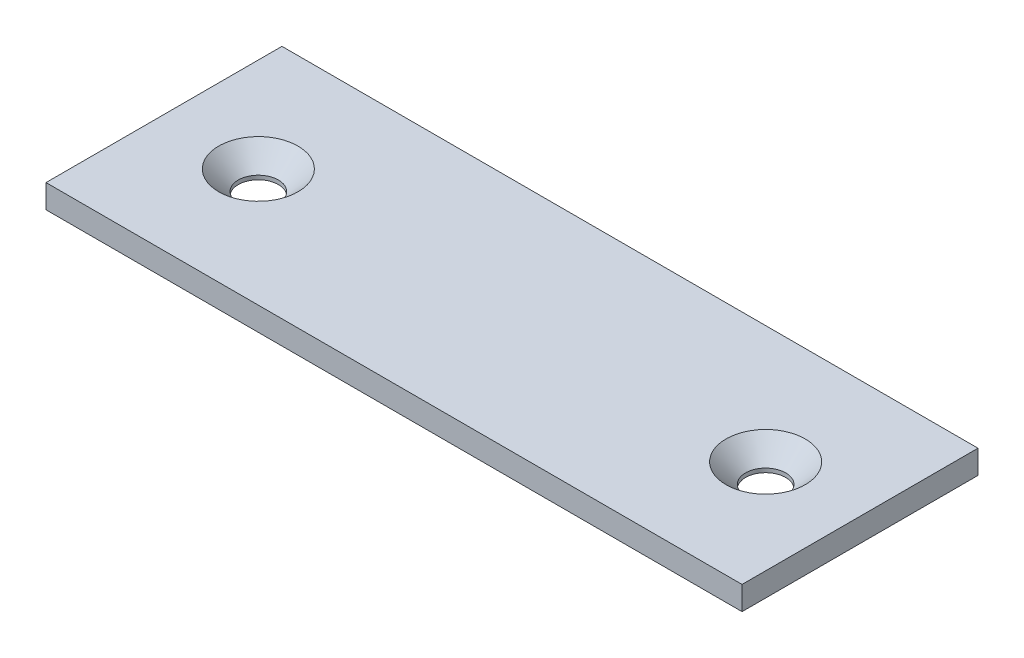
from build123d import *

# Parameters (mm, degrees)
EXTRUDE_765_DEPTH           = 10
EXTRUDE_765_DEPTH_BACK      = 10
HOLE_WIZARD_M3_2_AT_2_COUNT = 2
HOLE_WIZARD_M3_2_AT_2_PITCH = 43


with BuildPart() as part:
    # Sketch 1 → Extrude 765 (new, two sides: drawn at the far end of the back side and taken through both)
    with BuildSketch(Plane.XY.offset(-EXTRUDE_765_DEPTH_BACK)):
        Polygon((29.5, 0.5), (-29.5, 0.5), (-29.5, -1.5), (-13.5, -1.5), (13.5, -1.5), (29.5, -1.5), align=None)
        Polygon((29.5, 0.5), (-29.5, 0.5), (-29.5, -1.5), (-13.5, -1.5), (13.5, -1.5), (29.5, -1.5), align=None)
        Polygon((29.5, 0.5), (-29.5, 0.5), (-29.5, -1.5), (-13.5, -1.5), (13.5, -1.5), (29.5, -1.5), align=None)
        Polygon((29.5, 0.5), (-29.5, 0.5), (-29.5, -1.5), (-13.5, -1.5), (13.5, -1.5), (29.5, -1.5), align=None)
    extrude(amount=EXTRUDE_765_DEPTH + EXTRUDE_765_DEPTH_BACK)

    # 草图9 → M3*2 沉头孔 (revolve, cut)
    with BuildSketch(Plane(origin=(-21.5, 0.5, 0), x_dir=(0, 0, 1), z_dir=(1, 0, 0))):
        Polygon((0, 0), (0, 2), (1.7, 2), (1.7, 1.66), (3.36, 0), align=None)
    hole_wizard_m3_2 = revolve(axis=Axis((-21.5, 6.85, 0), (0, -1, 0)), mode=Mode.SUBTRACT)

    # M3*2 沉头孔 at 2: M3*2 沉头孔 ×2
    with Locations(*[(i * HOLE_WIZARD_M3_2_AT_2_PITCH, 0, 0) for i in range(1, HOLE_WIZARD_M3_2_AT_2_COUNT)]):
        add(hole_wizard_m3_2, mode=Mode.SUBTRACT)


solid = part.part
